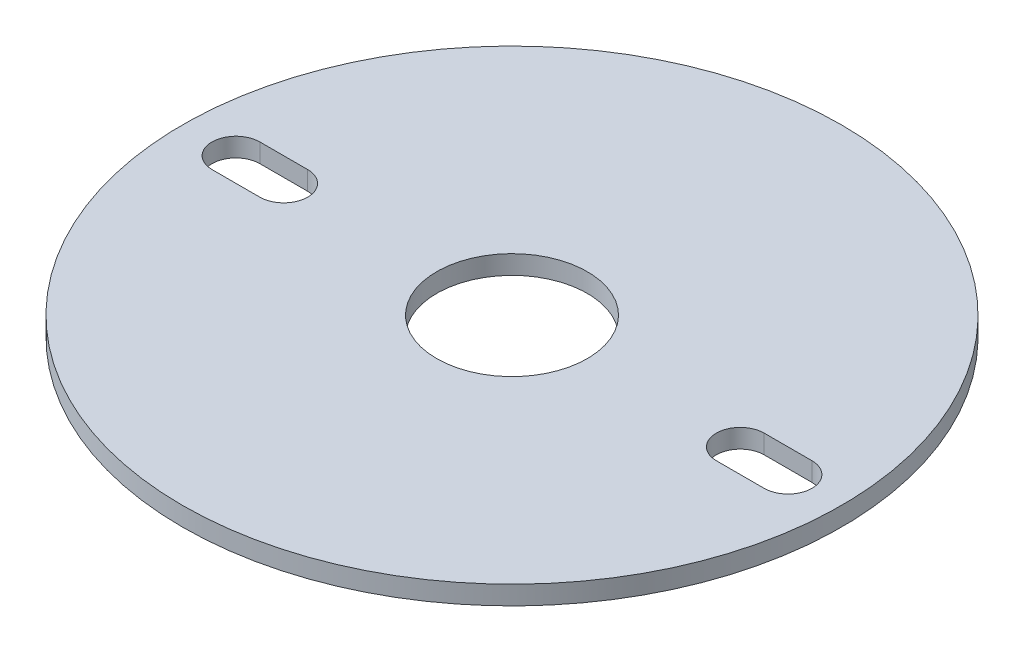
from build123d import *

# Parameters (mm, degrees)
SKETCH1_R           = 17.5
BOSS_EXTRUDE1_DEPTH = 1
SKETCH2_R           = 4
CUT_EXTRUDE1_DEPTH  = 5


with BuildPart() as part:
    # Sketch1 → Boss-Extrude1 (new body)
    with BuildSketch(Plane(origin=(0, 0, 0), x_dir=(1, 0, 0), z_dir=(0, 1, 0))):
        with Locations(Location((0, 0, 0), (0, 0, 270))):
            Circle(SKETCH1_R)
        with BuildLine():
            Line((14.66, 1.27), (12.12, 1.27))
            ThreePointArc((12.12, 1.27), (10.85, 0), (12.12, -1.27))
            Line((12.12, -1.27), (14.66, -1.27))
            ThreePointArc((14.66, -1.27), (15.93, 0), (14.66, 1.27))
        make_face(mode=Mode.SUBTRACT)
        with BuildLine():
            Line((-14.66, -1.27), (-12.12, -1.27))
            ThreePointArc((-12.12, -1.27), (-10.85, 0), (-12.12, 1.27))
            Line((-12.12, 1.27), (-14.66, 1.27))
            ThreePointArc((-14.66, 1.27), (-15.93, 0), (-14.66, -1.27))
        make_face(mode=Mode.SUBTRACT)
    extrude(amount=BOSS_EXTRUDE1_DEPTH)

    # Sketch2 → Cut-Extrude1 (cut, symmetric)
    with BuildSketch(Plane(origin=(0, 1, 0), x_dir=(1, 0, 0), z_dir=(0, 1, 0))):
        with Locations(Location((0, 0, 0), (0, 0, 270))):
            Circle(SKETCH2_R)
    extrude(amount=CUT_EXTRUDE1_DEPTH, both=True, mode=Mode.SUBTRACT)


solid = part.part
